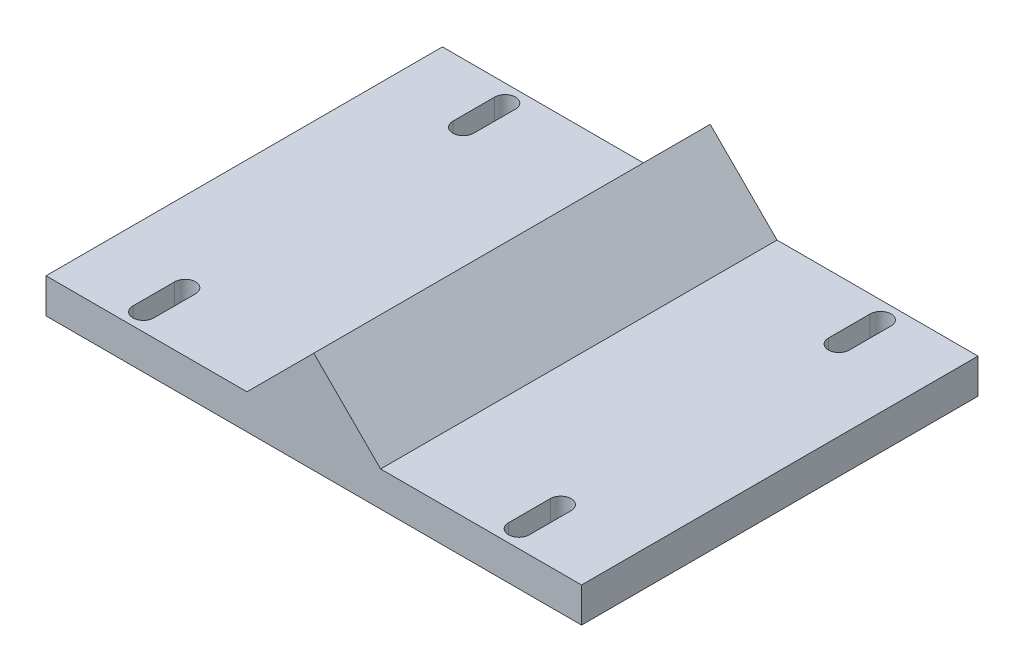
from build123d import *

# Parameters (mm, degrees)
BOSS_EXTRUDE1_DEPTH = 57
BOSS_EXTRUDE2_DEPTH = 14.3
CUT_EXTRUDE1_DEPTH  = 10


with BuildPart() as part:
    # Sketch1 → Boss-Extrude1 (new body)
    with BuildSketch(Plane.XY):
        Polygon((0, 0), (-7.54, -7.54), (-38.5, -7.54), (-38.5, -2.54), (-9.611067812, -2.54), (0, 7.071067812), (9.611067812, -2.54), (38.5, -2.54), (38.5, -7.54), (7.54, -7.54), align=None)
    extrude(amount=BOSS_EXTRUDE1_DEPTH)

    # Sketch2 → Boss-Extrude2 (add)
    with BuildSketch(Plane.XY.offset(57)):
        Polygon((-7.54, -7.54), (0, 0), (7.54, -7.54), align=None)
    extrude(amount=-BOSS_EXTRUDE2_DEPTH)

    # Sketch3 → Cut-Extrude1 (cut)
    with BuildSketch(Plane(origin=(0, -2.54, 0), x_dir=(1, 0, 0), z_dir=(0, 1, 0))):
        with BuildLine():
            Line((-25.499684651, -8.5), (-25.499684651, -2.5))
            ThreePointArc((-25.499684651, -2.5), (-27, -0.999684651), (-28.500315349, -2.5))
            Line((-28.500315349, -2.5), (-28.500315349, -8.5))
            ThreePointArc((-28.500315349, -8.5), (-27, -10.000315349), (-25.499684651, -8.5))
        make_face()
        with BuildLine():
            Line((28.500315349, -8.5), (28.500315349, -2.5))
            ThreePointArc((28.500315349, -2.5), (27, -0.999684651), (25.499684651, -2.5))
            Line((25.499684651, -2.5), (25.499684651, -8.5))
            ThreePointArc((25.499684651, -8.5), (27, -10.000315349), (28.500315349, -8.5))
        make_face()
        with BuildLine():
            Line((-25.499684651, -54.5), (-25.499684651, -48.5))
            ThreePointArc((-25.499684651, -48.5), (-27, -46.999684651), (-28.500315349, -48.5))
            Line((-28.500315349, -48.5), (-28.500315349, -54.5))
            ThreePointArc((-28.500315349, -54.5), (-27, -56.000315349), (-25.499684651, -54.5))
        make_face()
        with BuildLine():
            Line((28.500315349, -54.5), (28.500315349, -48.5))
            ThreePointArc((28.500315349, -48.5), (27, -46.999684651), (25.499684651, -48.5))
            Line((25.499684651, -48.5), (25.499684651, -54.5))
            ThreePointArc((25.499684651, -54.5), (27, -56.000315349), (28.500315349, -54.5))
        make_face()
    extrude(amount=-CUT_EXTRUDE1_DEPTH, mode=Mode.SUBTRACT)


solid = part.part
